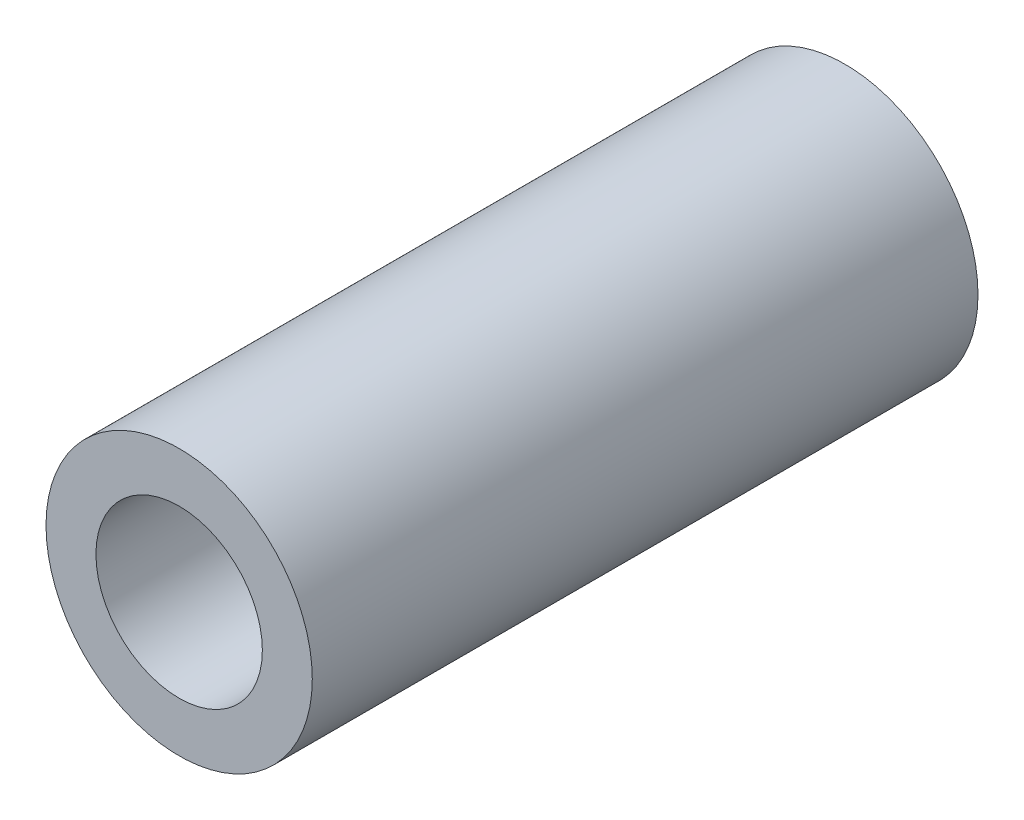
from build123d import *

# Parameters (mm, degrees)
SKETCH_1_R      = 4
SKETCH_1_R_2    = 2.5
EXTRUDE_1_DEPTH = 10


with BuildPart() as part:
    # 草图1 → 凸台-拉伸1 (new, symmetric)
    with BuildSketch(Plane.XY):
        Circle(SKETCH_1_R)
        Circle(SKETCH_1_R_2, mode=Mode.SUBTRACT)
    extrude(amount=EXTRUDE_1_DEPTH, both=True)


solid = part.part
